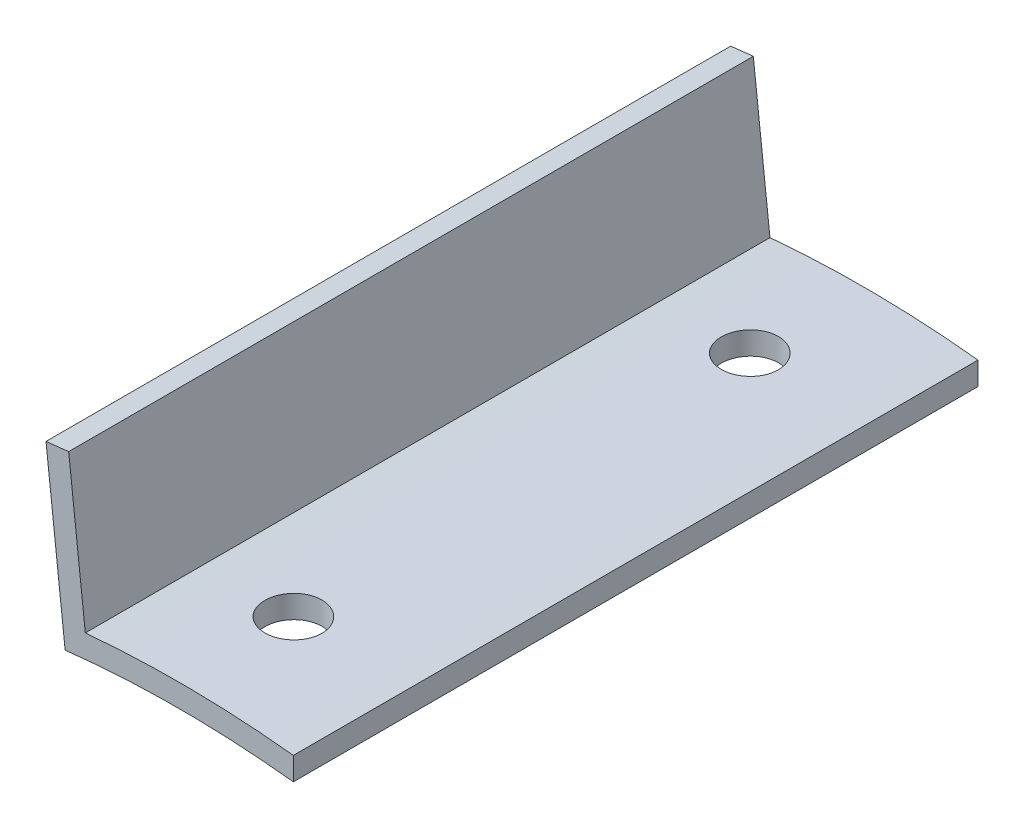
from build123d import *

# Parameters (mm, degrees)
BOSS_EXTRUDE1_DEPTH = 76.2
SKETCH2_R           = 3.175
CUT_EXTRUDE1_DEPTH  = 154.932715085


with BuildPart() as part:
    # Sketch1 → Boss-Extrude1 (new body)
    with BuildSketch(Plane.XY):
        with BuildLine():
            Line((-12.7, 113.592253257), (-14.829854749, 132.642253257))
            Line((-14.829854749, 132.642253257), (-12.305582454, 132.924475479))
            Line((-12.305582454, 132.924475479), (-10.454881932, 116.371306789))
            ThreePointArc((-10.454881932, 116.371306789), (1.128111355, 116.834553813), (12.7, 116.14773179))
            Line((12.7, 116.14773179), (12.7, 113.592253257))
            ThreePointArc((12.7, 113.592253257), (0, 114.3), (-12.7, 113.592253257))
        make_face()
    extrude(amount=BOSS_EXTRUDE1_DEPTH)

    # Sketch2 → Cut-Extrude1 (cut, through all)
    with BuildSketch(Plane(origin=(0, 0, 0), x_dir=(1, 0, 0), z_dir=(0, 1, 0))):
        with Locations(Location((0, -12.7, 0), (0, 0, 90))):
            Circle(SKETCH2_R)
        with Locations(Location((0, -63.5, 0), (0, 0, 90))):
            Circle(SKETCH2_R)
    extrude(amount=CUT_EXTRUDE1_DEPTH, mode=Mode.SUBTRACT)


solid = part.part
